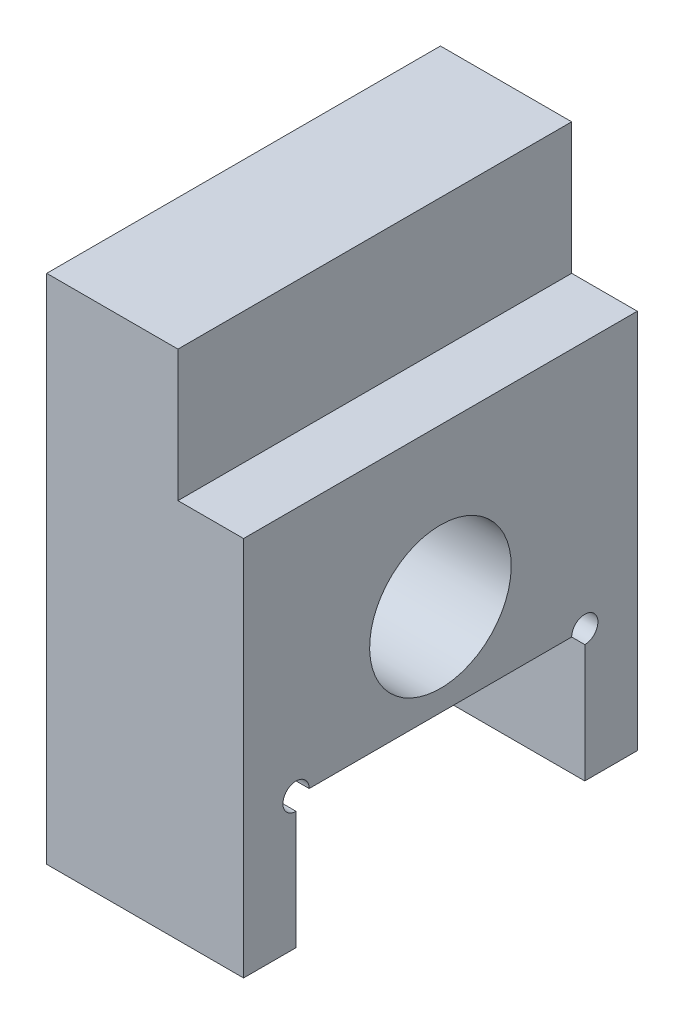
from build123d import *

# Parameters (mm, degrees)
RESSALTO_EXTRUS_O1_DEPTH = 30
ESBO_O2_W                = 22
ESBO_O2_H                = 10
CORTE_EXTRUS_O1_DEPTH    = 52.439284598
ESBO_O3_R                = 1
CORTE_EXTRUS_O2_DEPTH    = 52.439284598
ESBO_O4_R                = 5.395012771
CORTE_EXTRUS_O3_DEPTH    = 52.439284598


with BuildPart() as part:
    # Esboço1 → Ressalto-extrusão1 (new body)
    with BuildSketch(Plane.XY):
        Polygon((0, 0), (0, -39), (15, -39), (15, -10), (10, -10), (10, 0), align=None)
    extrude(amount=RESSALTO_EXTRUS_O1_DEPTH)

    # Esboço2 → Corte-extrusão1 (cut, through all)
    with BuildSketch(Plane(origin=(15, 0, 0), x_dir=(0, 0, -1), z_dir=(1, 0, 0))):
        with Locations((-15, -34)):
            Rectangle(ESBO_O2_W, ESBO_O2_H)
    extrude(amount=-CORTE_EXTRUS_O1_DEPTH, mode=Mode.SUBTRACT)

    # Esboço3 → Corte-extrusão2 (cut, through all)
    with BuildSketch(Plane(origin=(15, 0, 0), x_dir=(0, 0, -1), z_dir=(1, 0, 0))):
        with Locations((-26, -29)):
            Circle(ESBO_O3_R)
        with Locations((-4, -29)):
            Circle(ESBO_O3_R)
    extrude(amount=-CORTE_EXTRUS_O2_DEPTH, mode=Mode.SUBTRACT)

    # Esboço4 → Corte-extrusão3 (cut, through all)
    with BuildSketch(Plane(origin=(15, 0, 0), x_dir=(0, 0, -1), z_dir=(1, 0, 0))):
        with Locations(Location((-15, -22, 0), (0, 0, 90))):
            Circle(ESBO_O4_R)
    extrude(amount=-CORTE_EXTRUS_O3_DEPTH, mode=Mode.SUBTRACT)


solid = part.part
